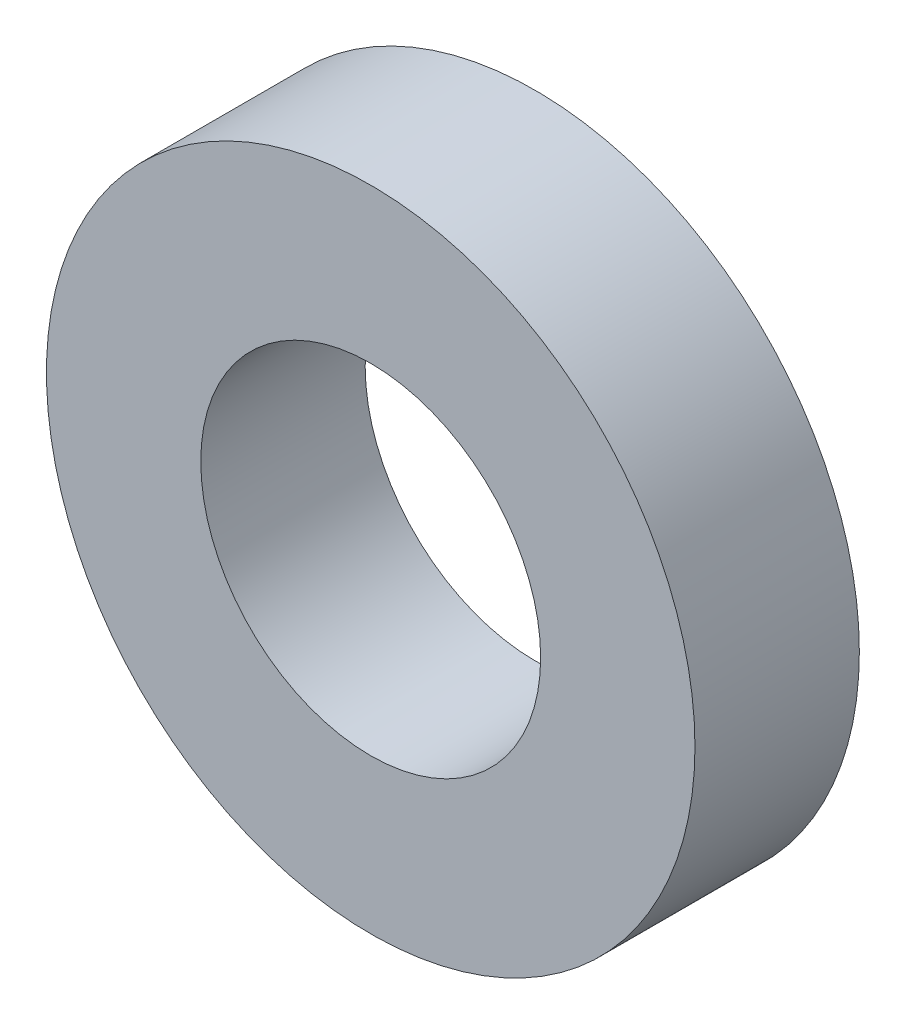
from build123d import *

# Parameters (mm, degrees)
ESQUISSE1_R        = 7.89
ESQUISSE1_R_2      = 4.135
BOSS_EXTRU_1_DEPTH = 4


with BuildPart() as part:
    # Esquisse1 → Boss.-Extru.1 (new body)
    with BuildSketch(Plane(origin=(0, 0, 0), x_dir=(0, 1, 0), z_dir=(0, 0, 1))):
        with Locations(Location((0, 0, 0), (0, 0, 270))):
            Circle(ESQUISSE1_R)
        with Locations(Location((0, 0, 0), (0, 0, 270))):
            Circle(ESQUISSE1_R_2, mode=Mode.SUBTRACT)
    extrude(amount=BOSS_EXTRU_1_DEPTH)


solid = part.part
